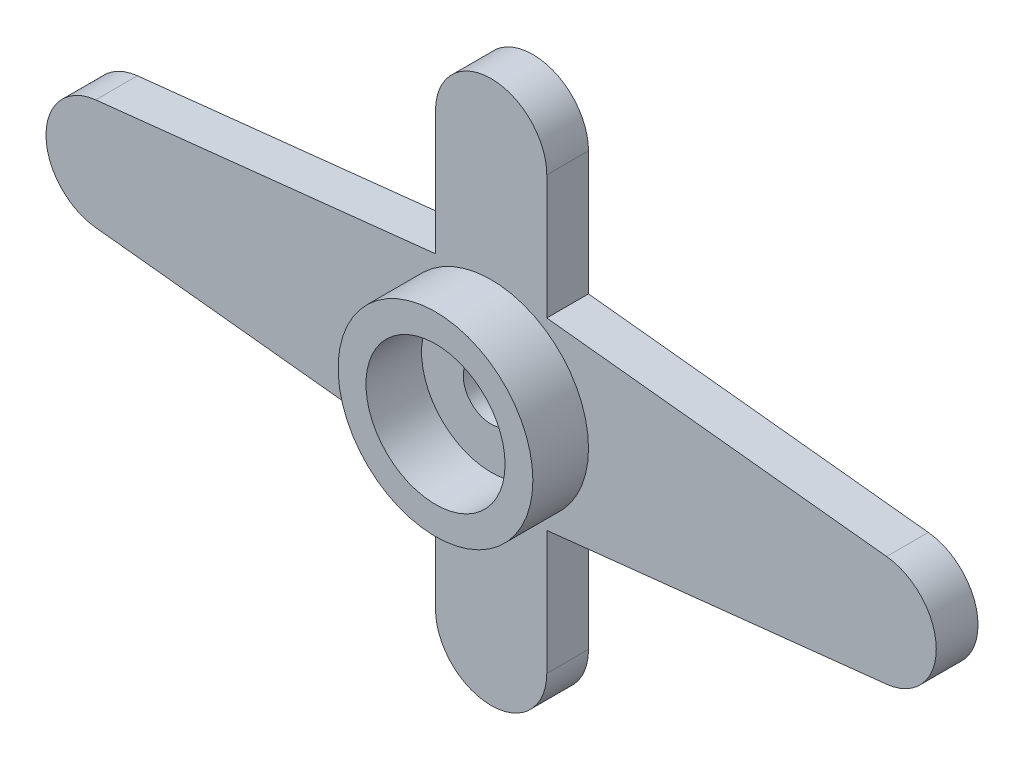
from build123d import *

# Parameters (mm, degrees)
BOSS_EXTRUDE1_DEPTH        = 1.5
SKETCH2_R                  = 3.5
SKETCH2_R_2                = 2.5
BOSS_EXTRUDE2_DEPTH        = 2.2
CUT_EXTRUDE1_REACH         = 20.87
SKETCH3_R                  = 1
SKETCH4_R                  = 2.5
CUT_EXTRUDE2_DEPTH         = 1
KES_EKSTR_ZYON1_DEPTH      = 10
KES_EKSTR_ZYON1_DEPTH_BACK = 10
IZIM1_W                    = 9.284710386
IZIM1_H                    = 2.096547507


with BuildPart() as part:
    # Sketch1 → Boss-Extrude1 (new body)
    with BuildSketch(Plane.XY):
        with BuildLine():
            Line((2, 7.75863865), (2, 3.304737557))
            Line((2, 3.304737557), (14.214285714, 1.988487272))
            ThreePointArc((14.214285714, 1.988487272), (16, 0), (14.214285714, -1.988487272))
            Line((14.214285714, -1.988487272), (2, -3.304737557))
            Line((2, -3.304737557), (2, -7.75863865))
            ThreePointArc((2, -7.75863865), (0, -9.75863865), (-2, -7.75863865))
            Line((-2, -7.75863865), (-2, -3.304737557))
            Line((-2, -3.304737557), (-14.214285714, -1.988487272))
            ThreePointArc((-14.214285714, -1.988487272), (-16, 0), (-14.214285714, 1.988487272))
            Line((-14.214285714, 1.988487272), (-2, 3.304737557))
            Line((-2, 3.304737557), (-2, 7.75863865))
            ThreePointArc((-2, 7.75863865), (0, 9.75863865), (2, 7.75863865))
        make_face()
    extrude(amount=BOSS_EXTRUDE1_DEPTH)

    # Sketch2 → Boss-Extrude2 (add)
    with BuildSketch(Plane.XY.offset(1.5)):
        Circle(SKETCH2_R)
        Circle(SKETCH2_R_2, mode=Mode.SUBTRACT)
    extrude(amount=BOSS_EXTRUDE2_DEPTH)

    # Sketch3 → Cut-Extrude1 (cut, up to next)
    with BuildSketch(Plane.XY.offset(1.5), mode=Mode.PRIVATE) as cut_extrude1_sk1:
        Circle(SKETCH3_R)
    cut_extrude1_tool1 = extrude(cut_extrude1_sk1.sketch, amount=-CUT_EXTRUDE1_REACH, mode=Mode.PRIVATE) & part.part
    add(cut_extrude1_tool1.solids().sort_by_distance((0, 0, 1.5))[0], mode=Mode.SUBTRACT)

    # Sketch4 → Cut-Extrude2 (cut)
    with BuildSketch(Plane(origin=(0, 0, 0), x_dir=(-1, 0, 0), z_dir=(0, 0, -1))):
        Circle(SKETCH4_R)
    extrude(amount=-CUT_EXTRUDE2_DEPTH, mode=Mode.SUBTRACT)

    # Çizim1 → Kes-Ekstrüzyon1 (cut, two sides: drawn at the far end of the back side and taken through both)
    with BuildSketch(Plane(origin=(0, 0, 0), x_dir=(1, 0, 0), z_dir=(0, 1, 0)).offset(-KES_EKSTR_ZYON1_DEPTH_BACK)):
        with Locations((-0.129205193, -4.548273754)):
            Rectangle(IZIM1_W, IZIM1_H)
    extrude(amount=KES_EKSTR_ZYON1_DEPTH + KES_EKSTR_ZYON1_DEPTH_BACK, mode=Mode.SUBTRACT)


solid = part.part
